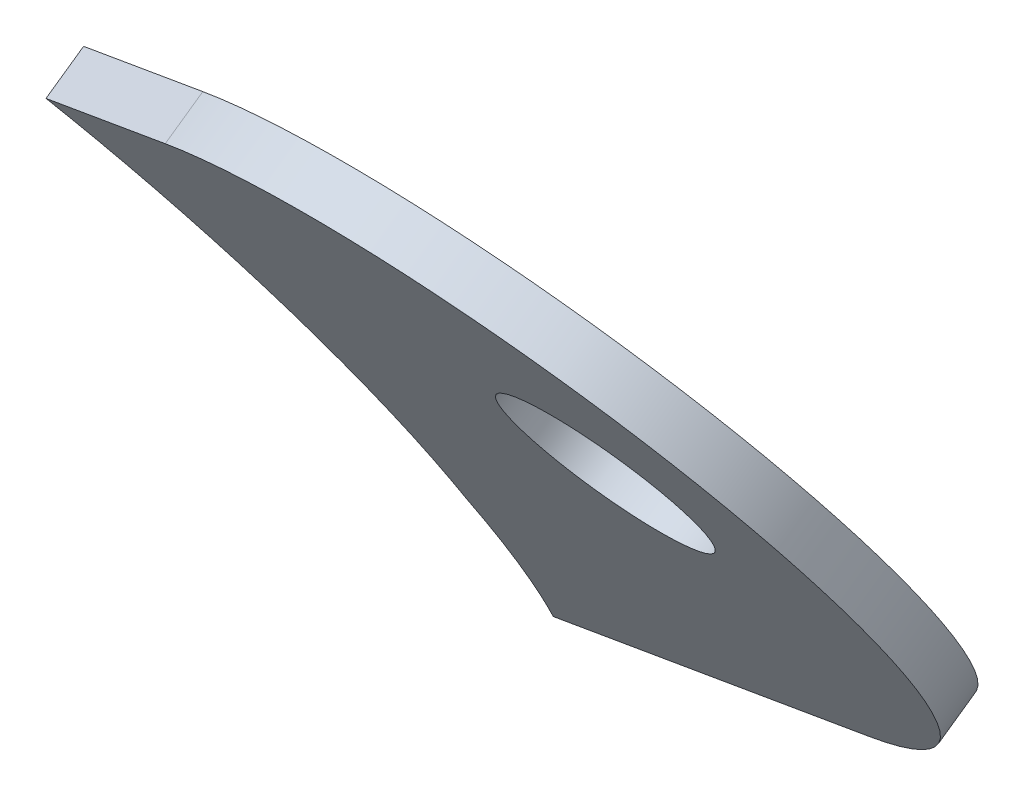
from build123d import *

# Parameters (mm, degrees)
SKETCH1_R           = 3.3020000000000405
BOSS_EXTRUDE1_DEPTH = 1.5875
SKETCH2_R           = 12.7
CUT_EXTRUDE1_DEPTH  = 164.69798740092241
CUT_EXTRUDE2_DEPTH  = 399.2312021708926
CUT_EXTRUDE3_DEPTH  = 399.2322845032196


with BuildPart() as part:
    # Sketch1 → Boss-Extrude1 (new body)
    with BuildSketch(Plane(origin=(-4.904e-14, 229.6997332170858, -328.0452161431734), x_dir=(1, 7e-17, -1e-16), z_dir=(0, -0.5735764363510497, 0.8191520442889892))):
        with BuildLine():
            Line((356.2998896252525, 70.55163741306428), (376.9254322382814, 80.82199071424783))
            ThreePointArc((376.9254322382814, 80.82199071424783), (382.63309358192566, 97.85145347695013), (365.6036308192234, 103.55911482059432))
            Line((365.6036308192234, 103.55911482059432), (344.97808820619434, 93.28876151941097))
            Line((344.97808820619434, 93.28876151941097), (356.2998896252525, 70.55163741306428))
        make_face()
        with Locations(Location((375.5277422986924, 94.3133905334945, 0), (0, 0, 270))):
            Circle(SKETCH1_R, mode=Mode.SUBTRACT)
    extrude(amount=BOSS_EXTRUDE1_DEPTH)

    # Sketch2 → Cut-Extrude1 (cut, through all)
    with BuildSketch(Plane(origin=(364.35174229869244, 343.62540364794484, -135.39966553044988), x_dir=(-0.9960075449626111, 0.027318171664055604, 0.08498639817338811), z_dir=(-0.0892690897094424, -0.3047987291070713, -0.9482240053685426))):
        Circle(SKETCH2_R)
    extrude(amount=CUT_EXTRUDE1_DEPTH, mode=Mode.SUBTRACT)

    # Sketch3 → Cut-Extrude2 (cut, through all)
    with BuildSketch(Plane(origin=(-4.885e-14, 228.78918062437845, -326.7448122728647), x_dir=(1, 7e-17, -1e-16), z_dir=(0, -0.5735764363510497, 0.8191520442889892))):
        with BuildLine():
            Line((359.8287026568516, 100.68352732070262), (358.4382239247449, 99.99114758047237))
            Line((358.4382239247449, 99.99114758047237), (360.8702636019665, 72.82742507790554))
            add(Edge.make_bspline(
                [(360.8702636019665, 72.82742507790554), (368.2083080665997, 89.03003410456597), (359.8287026568516, 100.68352732070262)],
                knots=[4.218717035603661, 4.218717035603661, 4.218717035603661, 5.696136664554478, 5.696136664554478, 5.696136664554478], degree=2, weights=[1, 0.7393379003717987, 1]))
        make_face()
    extrude(amount=-CUT_EXTRUDE2_DEPTH, mode=Mode.SUBTRACT)

    # Sketch4 → Cut-Extrude3 (cut, through all)
    with BuildSketch(Plane(origin=(-4.904e-14, 229.6997332170858, -328.0452161431734), x_dir=(-1, -7e-17, 1e-16), z_dir=(0, 0.5735764363510497, -0.8191520442889892))):
        with BuildLine():
            Line((-361.6174533376439, 73.19948329292563), (-360.8702636019665, 72.82742507790549))
            Line((-360.8702636019665, 72.82742507790549), (-363.361378453228, 81.54873685940132))
            add(Edge.make_bspline(
                [(-363.361378453228, 81.54873685940132), (-363.00233152155374, 77.177344146135), (-361.6174533376439, 73.19948329292563)],
                knots=[1.5208655376076283, 1.5208655376076283, 1.5208655376076283, 1.9311023959162479, 1.9311023959162479, 1.9311023959162479], degree=2, weights=[1, 0.9790368693670761, 1]))
        make_face()
    extrude(amount=-CUT_EXTRUDE3_DEPTH, mode=Mode.SUBTRACT)


solid = part.part
